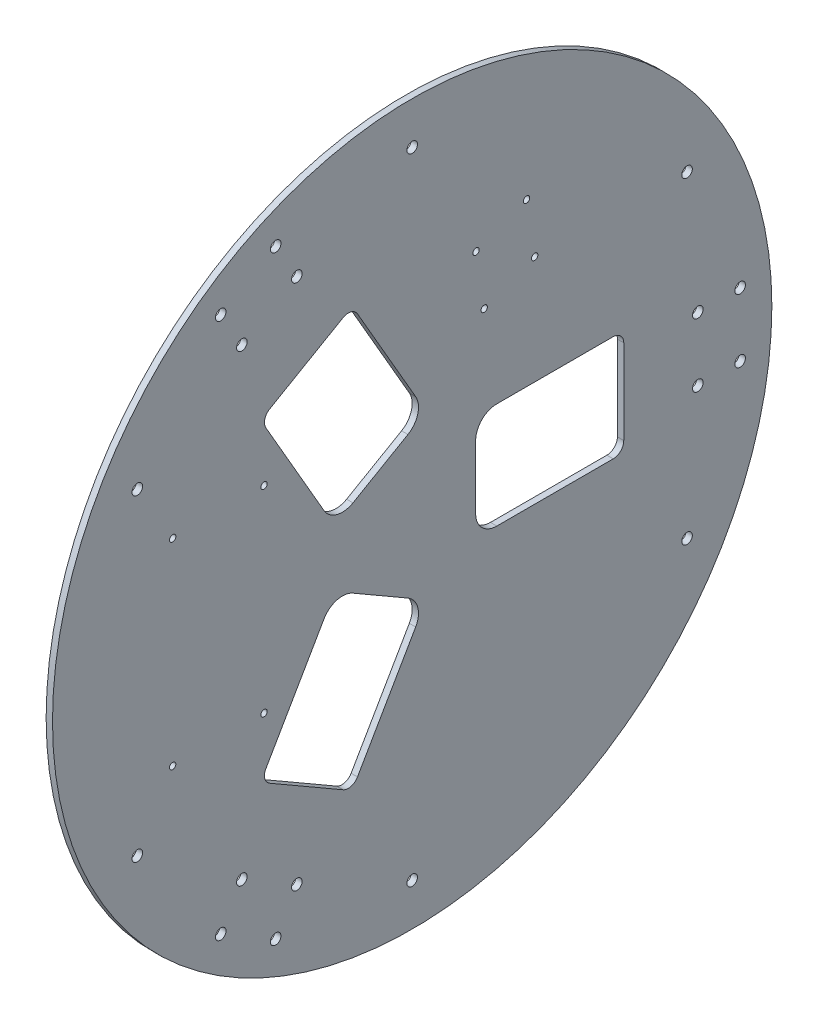
from build123d import *

# Parameters (mm, degrees)
SKETCH_1_R      = 170
SKETCH_1_R_2    = 2.5
SKETCH_1_R_3    = 1.5
EXTRUDE_1_DEPTH = 3


with BuildPart() as part:
    # 草图1 → 凸台-拉伸1 (new body)
    with BuildSketch(Plane(origin=(0, 0, 0), x_dir=(0, 0, -1), z_dir=(1, 0, 0))):
        Circle(SKETCH_1_R)
        with Locations((155, 15)):
            Circle(SKETCH_1_R_2, mode=Mode.SUBTRACT)
        with Locations((135, 15)):
            Circle(SKETCH_1_R_2, mode=Mode.SUBTRACT)
        with Locations(Location((135, -15, 0), (0, 0, 180))):
            Circle(SKETCH_1_R_2, mode=Mode.SUBTRACT)
        with Locations(Location((155, -15, 0), (0, 0, 180))):
            Circle(SKETCH_1_R_2, mode=Mode.SUBTRACT)
        with Locations((-90.490381057, 126.733937587)):
            Circle(SKETCH_1_R_2, mode=Mode.SUBTRACT)
        with Locations((-80.490381057, 109.413429511)):
            Circle(SKETCH_1_R_2, mode=Mode.SUBTRACT)
        with Locations(Location((-54.509618943, 124.413429511, 0), (0, 0, 180))):
            Circle(SKETCH_1_R_2, mode=Mode.SUBTRACT)
        with Locations(Location((-64.509618943, 141.733937587, 0), (0, 0, 180))):
            Circle(SKETCH_1_R_2, mode=Mode.SUBTRACT)
        with Locations((-64.509618943, -141.733937587)):
            Circle(SKETCH_1_R_2, mode=Mode.SUBTRACT)
        with Locations((-54.509618943, -124.413429511)):
            Circle(SKETCH_1_R_2, mode=Mode.SUBTRACT)
        with Locations(Location((-80.490381057, -109.413429511, 0), (0, 0, 180))):
            Circle(SKETCH_1_R_2, mode=Mode.SUBTRACT)
        with Locations(Location((-90.490381057, -126.733937587, 0), (0, 0, 180))):
            Circle(SKETCH_1_R_2, mode=Mode.SUBTRACT)
        with Locations((-70, 46.6)):
            Circle(SKETCH_1_R_3, mode=Mode.SUBTRACT)
        with Locations((-113.2, 46.6)):
            Circle(SKETCH_1_R_3, mode=Mode.SUBTRACT)
        with Locations(Location((-113.2, -46.6, 0), (0, 0, 180))):
            Circle(SKETCH_1_R_3, mode=Mode.SUBTRACT)
        with Locations(Location((-70, -46.6, 0), (0, 0, 180))):
            Circle(SKETCH_1_R_3, mode=Mode.SUBTRACT)
        with Locations((0, -150)):
            Circle(SKETCH_1_R_2, mode=Mode.SUBTRACT)
        with Locations((-129.903810568, -75)):
            Circle(SKETCH_1_R_2, mode=Mode.SUBTRACT)
        with Locations((-129.903810568, 75)):
            Circle(SKETCH_1_R_2, mode=Mode.SUBTRACT)
        with Locations((0, 150)):
            Circle(SKETCH_1_R_2, mode=Mode.SUBTRACT)
        with Locations((129.903810568, 75)):
            Circle(SKETCH_1_R_2, mode=Mode.SUBTRACT)
        with Locations((129.903810568, -75)):
            Circle(SKETCH_1_R_2, mode=Mode.SUBTRACT)
        with Locations((54.035898385, 101.592921435)):
            Circle(SKETCH_1_R_3, mode=Mode.SUBTRACT)
        with Locations((34.035898385, 66.951905284)):
            Circle(SKETCH_1_R_3, mode=Mode.SUBTRACT)
        with Locations((57.892304845, 76.27241336)):
            Circle(SKETCH_1_R_3, mode=Mode.SUBTRACT)
        with Locations((30.179491924, 92.27241336)):
            Circle(SKETCH_1_R_3, mode=Mode.SUBTRACT)
        with BuildLine():
            Line((100, 0), (100, 20))
            ThreePointArc((100, 20), (98.535533906, 23.535533906), (95, 25))
            Line((95, 25), (40, 25))
            ThreePointArc((40, 25), (32.928932188, 22.071067812), (30, 15))
            Line((30, 15), (30, -15))
            ThreePointArc((30, -15), (32.928932188, -22.071067812), (40, -25))
            Line((40, -25), (95, -25))
            ThreePointArc((95, -25), (98.535533906, -23.535533906), (100, -20))
            Line((100, -20), (100, 0))
        make_face(mode=Mode.SUBTRACT)
        with BuildLine():
            Line((-50, 86.602540378), (-67.320508076, 76.602540378))
            ThreePointArc((-67.320508076, 76.602540378), (-69.650137207, 73.566508585), (-69.150635095, 69.77241336))
            Line((-69.150635095, 69.77241336), (-41.650635095, 22.141016151))
            ThreePointArc((-41.650635095, 22.141016151), (-35.578571508, 17.481757888), (-27.990381057, 18.480762114))
            Line((-27.990381057, 18.480762114), (-2.009618943, 33.480762114))
            ThreePointArc((-2.009618943, 33.480762114), (2.64963932, 39.5528257), (1.650635095, 47.141016151))
            Line((1.650635095, 47.141016151), (-25.849364905, 94.77241336))
            ThreePointArc((-25.849364905, 94.77241336), (-28.885396699, 97.102042491), (-32.679491924, 96.602540378))
            Line((-32.679491924, 96.602540378), (-50, 86.602540378))
        make_face(mode=Mode.SUBTRACT)
        with BuildLine():
            Line((-50, -86.602540378), (-32.679491924, -96.602540378))
            ThreePointArc((-32.679491924, -96.602540378), (-28.885396699, -97.102042491), (-25.849364905, -94.77241336))
            Line((-25.849364905, -94.77241336), (1.650635095, -47.141016151))
            ThreePointArc((1.650635095, -47.141016151), (2.64963932, -39.5528257), (-2.009618943, -33.480762114))
            Line((-2.009618943, -33.480762114), (-27.990381057, -18.480762114))
            ThreePointArc((-27.990381057, -18.480762114), (-35.578571508, -17.481757888), (-41.650635095, -22.141016151))
            Line((-41.650635095, -22.141016151), (-69.150635095, -69.77241336))
            ThreePointArc((-69.150635095, -69.77241336), (-69.650137207, -73.566508585), (-67.320508076, -76.602540378))
            Line((-67.320508076, -76.602540378), (-50, -86.602540378))
        make_face(mode=Mode.SUBTRACT)
    extrude(amount=EXTRUDE_1_DEPTH)


solid = part.part
